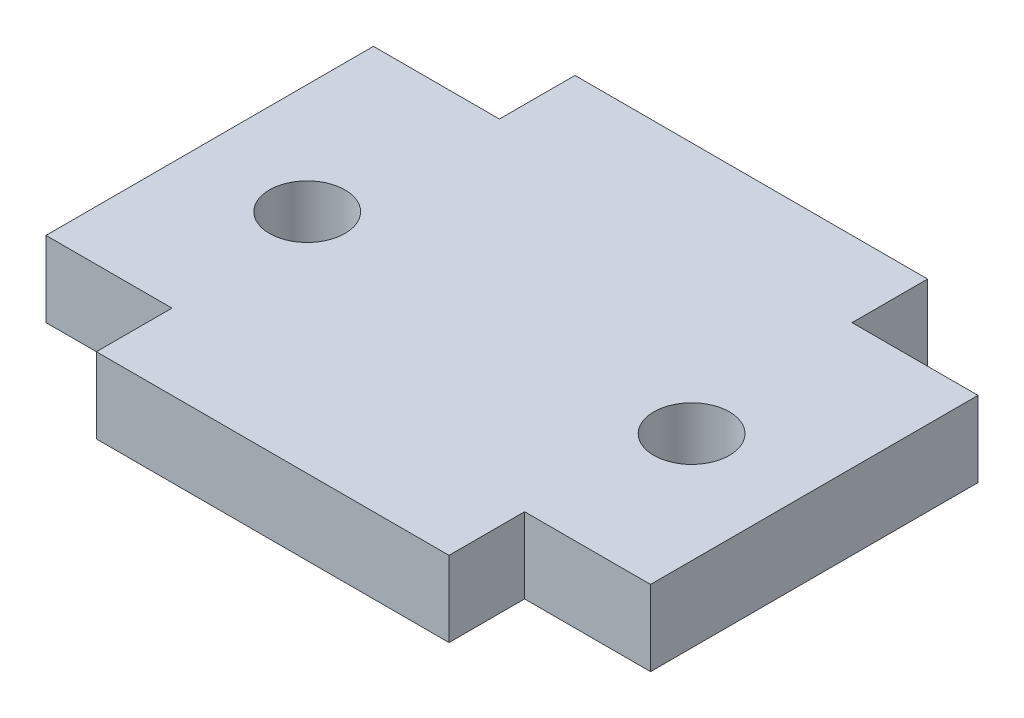
from build123d import *

# Parameters (mm, degrees)
CROQUIS1_R              = 1.5
SALIENTE_EXTRUIR1_DEPTH = 3


with BuildPart() as part:
    # Croquis1 → Saliente-Extruir1 (new body)
    with BuildSketch(Plane(origin=(0, 0, 0), x_dir=(1, 0, 0), z_dir=(0, 1, 0))):
        Polygon((0, 0), (0, 13), (5, 13), (5, 16), (19, 16), (19, 13), (24, 13), (24, 0), (19, 0), (19, -3), (5, -3), (5, 0), align=None)
        with Locations(Location((4.37, 6, 0), (0, 0, 270))):
            Circle(CROQUIS1_R, mode=Mode.SUBTRACT)
        with Locations(Location((19.63, 6, 0), (0, 0, 90))):
            Circle(CROQUIS1_R, mode=Mode.SUBTRACT)
    extrude(amount=SALIENTE_EXTRUIR1_DEPTH)


solid = part.part
